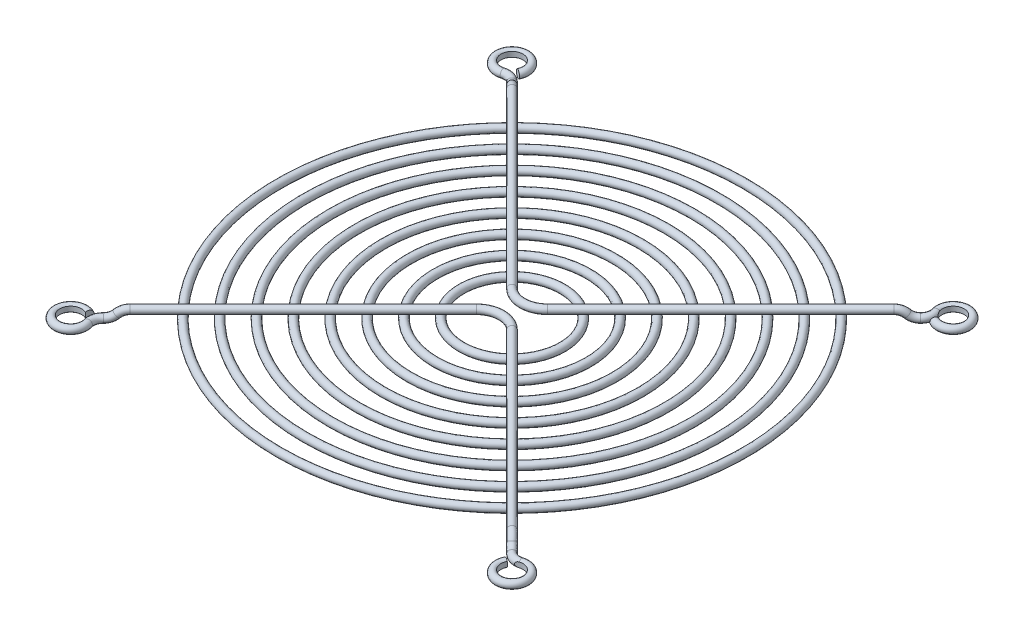
from build123d import *

# Parameters (mm, degrees)
SKETCH_1_R                 = 0.9
SWEEP_1_PROFILE_R          = 0.9
SWEEP_2_PROFILE_R          = 0.9
SWEEP_3_PROFILE_R          = 0.9
SKETCH_50_R                = 2.6
CUT_EXTRUDE_1_DEPTH        = 81.181858317
PATTERN_CIRCULAR_5_COUNT   = 4
PATTERN_CIRCULAR_5_2_COUNT = 4


with BuildPart() as part:
    # Эскиз1 → Повернуть1 (revolve)
    with BuildSketch(Plane(origin=(0, 0, 0), x_dir=(0, 0, -1), z_dir=(1, 0, 0)), mode=Mode.PRIVATE) as revolve_1_sk:
        with Locations((12, -1.8)):
            Circle(SKETCH_1_R)
        with Locations((18.2, -1.8)):
            Circle(SKETCH_1_R)
        with Locations((24.4, -1.8)):
            Circle(SKETCH_1_R)
        with Locations((30.6, -1.8)):
            Circle(SKETCH_1_R)
        with Locations((36.8, -1.8)):
            Circle(SKETCH_1_R)
        with Locations((43, -1.8)):
            Circle(SKETCH_1_R)
        with Locations((49.2, -1.8)):
            Circle(SKETCH_1_R)
        with Locations((55.4, -1.8)):
            Circle(SKETCH_1_R)
    revolve(revolve_1_sk.sketch.rotate(Axis((0, -1.8, 0), (0, -1, 0)), 180), axis=Axis((0, -1.8, 0), (0, -1, 0)))


with BuildPart() as body_2:
    # По траектории1: sweep along a path in Эскиз2
    with BuildLine(Plane(origin=(0, 0, 0), x_dir=(1, 0, 0), z_dir=(0, 1, 0))) as sweep_1_path:
        Line((-45.428932188, 45.428932188), (-4.242640687, 4.242640687))
        ThreePointArc((-4.242640687, 4.242640687), (0, 2.485281374), (4.242640687, 4.242640687))
        Line((4.242640687, 4.242640687), (45.428932188, 45.428932188))
    # По траектории1 profile (on start of the path) → По траектории1 (sweep)
    with BuildSketch(Plane(origin=(-45.428932188, 0, -45.428932188), x_dir=(0.7071067811865489, 0, -0.7071067811865461), z_dir=(0.7071067811865461, 0, 0.7071067811865489))):
        Circle(SWEEP_1_PROFILE_R)
    sweep(path=sweep_1_path.line)


with BuildPart() as body_3:
    # Зеркальное отражение6: mirrored copy
    add(body_2.part.mirror(Plane.XY))


with BuildPart() as body_4:
    # По траектории2: sweep along a path in Эскиз4
    with BuildLine(Plane(origin=(0, -1.8, 0), x_dir=(1, 0, 0), z_dir=(0, 1, 0))) as sweep_2_path:
        ThreePointArc((48.610912703, 48.610912703), (49.396571905, 49.990970663), (49.367688865, 51.578732019))
        ThreePointArc((49.367688865, 51.578732019), (55.015262293, 54.581721245), (51.009368428, 49.595154865))
    # По траектории2 profile (on start of the path) → По траектории2 (sweep)
    with BuildSketch(Plane(origin=(48.610912703, -1.8, -48.610912703), x_dir=(0.707106781186538, 0, 0.707106781186557), z_dir=(0.707106781186557, 0, -0.707106781186538))):
        Circle(SWEEP_2_PROFILE_R)
    sweep_2 = sweep(path=sweep_2_path.line)


with BuildPart() as body_2_1:
    add(body_2.part)

    add(body_4.part)  # По траектории3 merges body 4
    # По траектории3: sweep along a path in Эскиз3
    with BuildLine(Plane(origin=(0, 0, 0), x_dir=(0.7071067811865462, 0, -0.7071067811865488), z_dir=(0.7071067811865488, 0, 0.7071067811865462))) as sweep_3_path:
        ThreePointArc((64.246212025, 0), (65.457874106, -0.233344796), (66.496212025, -0.9))
        ThreePointArc((66.496212025, -0.9), (67.534549943, -1.566655204), (68.746212025, -1.8))
    # По траектории3 profile (on start of the path) → По траектории3 (sweep)
    with BuildSketch(Plane(origin=(45.428932188, 0, -45.428932188), x_dir=(-0.7071067811865488, 0, -0.7071067811865464), z_dir=(0.7071067811865464, 0, -0.7071067811865488))):
        Circle(SWEEP_3_PROFILE_R)
    sweep_3 = sweep(path=sweep_3_path.line)

    # Эскиз50 → Вырез-Вытянуть1 (cut, symmetric)
    with BuildSketch(Plane(origin=(0, 0, 0), x_dir=(1, 0, 0), z_dir=(0, 1, 0))):
        with Locations((52.5, 52.5)):
            Circle(SKETCH_50_R)
    cut_extrude_1 = extrude(amount=CUT_EXTRUDE_1_DEPTH, both=True, mode=Mode.SUBTRACT)

    add(body_3.part)  # Круговой массив5 merges body 3
    # Круговой массив5: По траектории2, По траектории3 ×4 about axis
    pattern_circular_5_axis = Axis((0, 0, 0), (0, 1, 0))
    add([sweep_2.rotate(pattern_circular_5_axis, i * 360 / PATTERN_CIRCULAR_5_COUNT) for i in range(1, PATTERN_CIRCULAR_5_COUNT)])
    add([sweep_3.rotate(pattern_circular_5_axis, i * 360 / PATTERN_CIRCULAR_5_COUNT) for i in range(1, PATTERN_CIRCULAR_5_COUNT)])

    # Pattern Circular 5 2: Вырез-Вытянуть1 ×4 about axis
    pattern_circular_5_2_axis = Axis((0, 0, 0), (0, 1, 0))
    for i in range(1, PATTERN_CIRCULAR_5_2_COUNT):
        add(cut_extrude_1.rotate(pattern_circular_5_2_axis, i * 360 / PATTERN_CIRCULAR_5_2_COUNT), mode=Mode.SUBTRACT)


solid = Compound([part.part, body_2_1.part])
